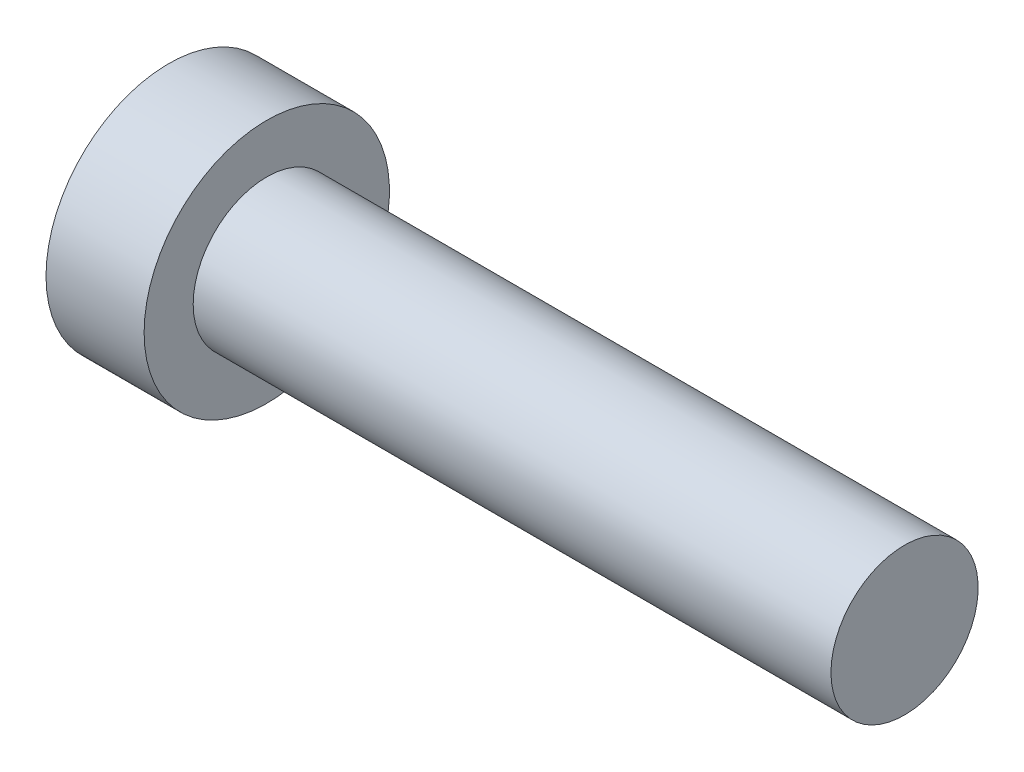
from build123d import *

# Parameters (mm, degrees)
CUT_EXTRUDE1_DEPTH = 2.38


with BuildPart() as part:
    # Sketch1 → Revolve1 (revolve)
    with BuildSketch(Plane.XY, mode=Mode.PRIVATE) as revolve1_sk:
        Polygon((0, 0), (30, 0), (30, 3), (4, 3), (4, 5), (0, 5), align=None)
    revolve(revolve1_sk.sketch.rotate(Axis((0, 0, 0), (1, 0, 0)), 90), axis=Axis((0, 0, 0), (1, 0, 0)))

    # Sketch2 → Cut-Extrude1 (cut)
    with BuildSketch(Plane.ZY):
        Polygon((2.886751346, 0), (1.443375673, 2.5), (-1.443375673, 2.5), (-2.886751346, 0), (-1.443375673, -2.5), (1.443375673, -2.5), align=None)
    extrude(amount=-CUT_EXTRUDE1_DEPTH, mode=Mode.SUBTRACT)


solid = part.part
